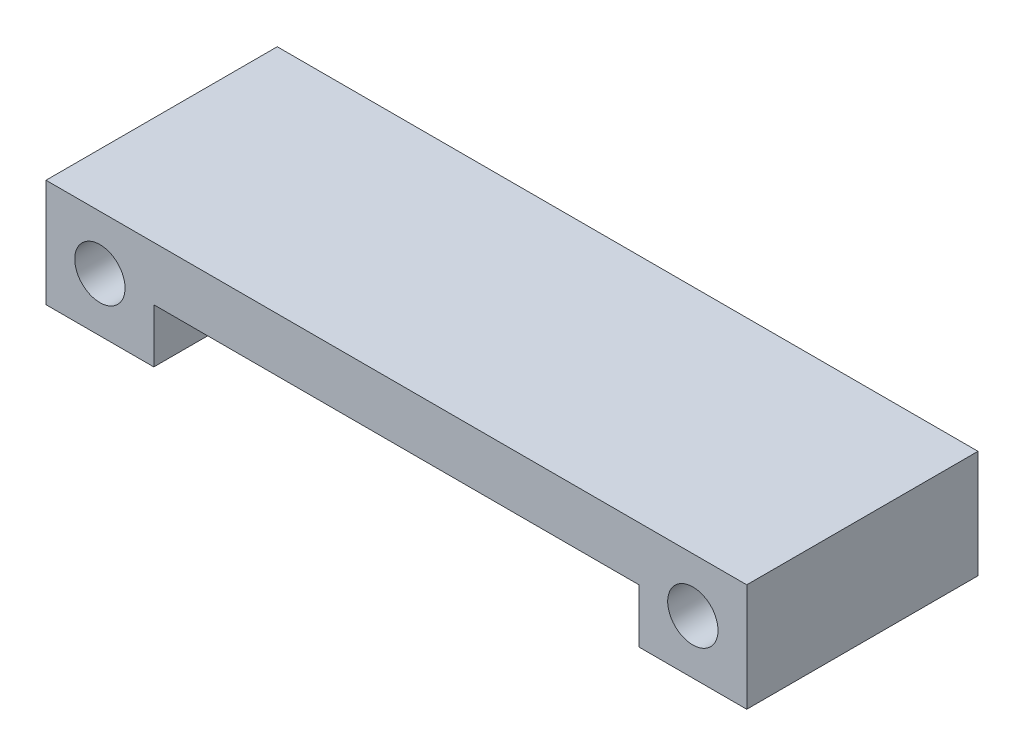
from build123d import *

# Parameters (mm, degrees)
SKETCH1_R           = 1.4
BOSS_EXTRUDE1_DEPTH = 12.87


with BuildPart() as part:
    # Sketch1 → Boss-Extrude1 (new body)
    with BuildSketch(Plane.XY):
        Polygon((-13.5, 0), (-13.5, -3), (-19.5, -3), (-19.5, 3), (19.5, 3), (19.5, -3), (13.5, -3), (13.5, 0), align=None)
        with Locations((16.5, 0)):
            Circle(SKETCH1_R, mode=Mode.SUBTRACT)
        with Locations((-16.5, 0)):
            Circle(SKETCH1_R, mode=Mode.SUBTRACT)
    extrude(amount=BOSS_EXTRUDE1_DEPTH)


solid = part.part
